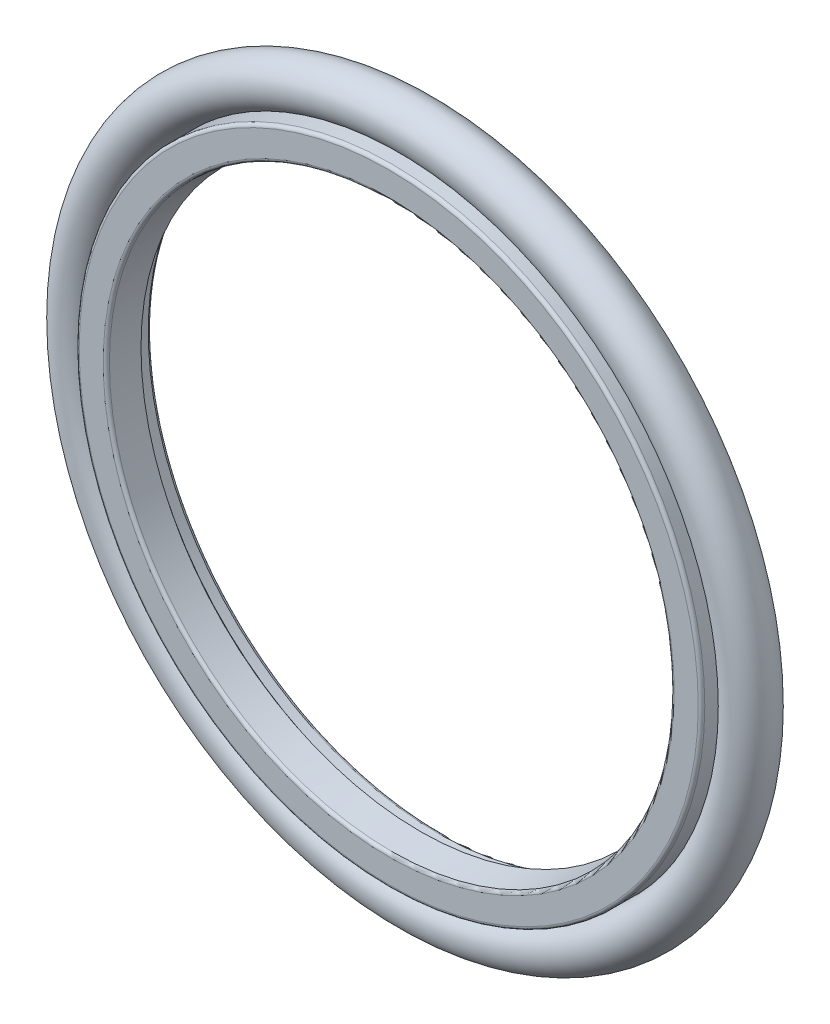
from build123d import *

# Parameters (mm, degrees)
SKETCH2_R = 1.75


with BuildPart() as part:
    # Sketch1 → Revolve1 (revolve)
    with BuildSketch(Plane(origin=(0, 0, 0), x_dir=(0, 0, -1), z_dir=(1, 0, 0)), mode=Mode.PRIVATE) as revolve1_sk:
        with BuildLine():
            Line((0.25, 23.8), (3.75, 23.8))
            ThreePointArc((3.75, 23.8), (3.926776695, 23.726776695), (4, 23.55))
            Line((4, 23.55), (4, 22.3))
            ThreePointArc((4, 22.3), (3.926776695, 22.123223305), (3.75, 22.05))
            Line((3.75, 22.05), (3, 22.05))
            Line((3, 22.05), (2.4, 21.25))
            Line((2.4, 21.25), (0.224098479, 21.476656408))
            ThreePointArc((0.224098479, 21.476656408), (0.064291384, 21.557942227), (0, 21.725311011))
            Line((0, 21.725311011), (0, 23.55))
            ThreePointArc((0, 23.55), (0.073223305, 23.726776695), (0.25, 23.8))
        make_face()
    revolve(revolve1_sk.sketch.rotate(Axis((0, 0, 0), (0, 0, -1)), 90), axis=Axis((0, 0, 0), (0, 0, -1)))


with BuildPart() as body_2:
    # Sketch2 → Revolve2 (revolve)
    with BuildSketch(Plane(origin=(0, 0, 0), x_dir=(0, 0, -1), z_dir=(1, 0, 0)), mode=Mode.PRIVATE) as revolve2_sk:
        with Locations((2, 25.55)):
            Circle(SKETCH2_R)
    revolve(revolve2_sk.sketch.rotate(Axis((0, 0, 0), (0, 0, -1)), 270), axis=Axis((0, 0, 0), (0, 0, -1)))


solid = Compound([part.part, body_2.part])
